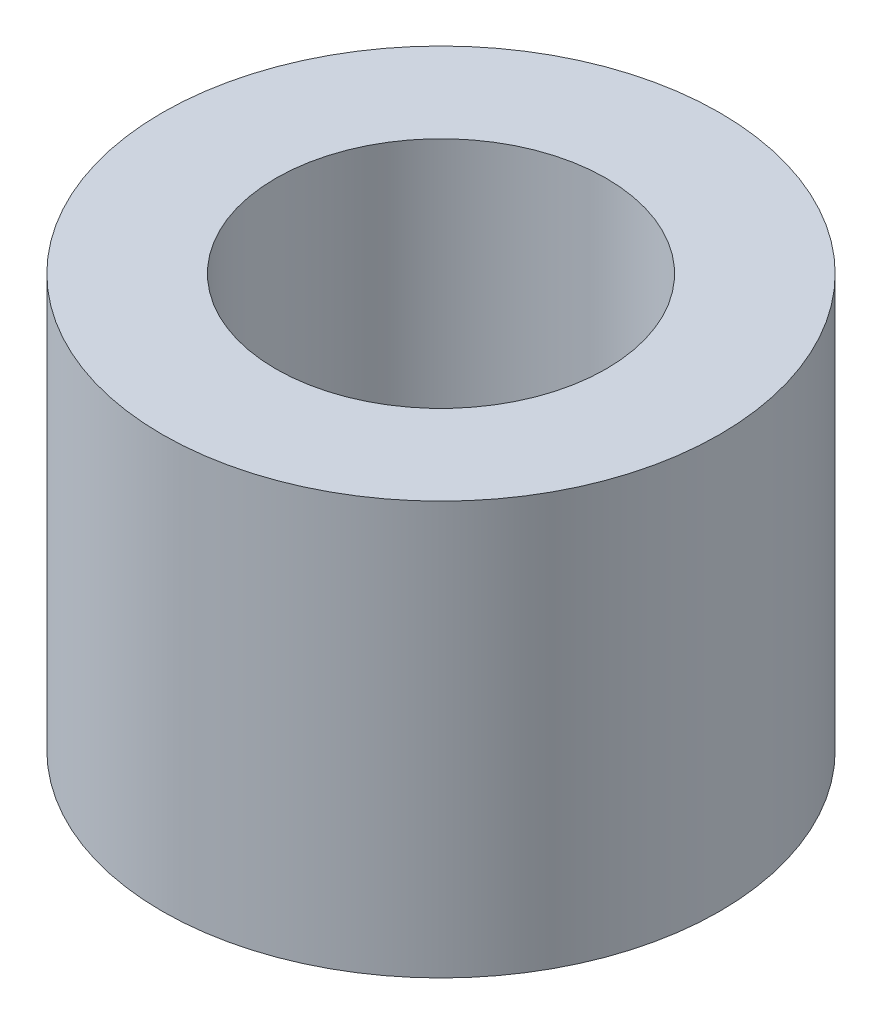
from build123d import *

# Parameters (mm, degrees)
SKETCH_1_R      = 2.7
SKETCH_1_R_2    = 1.6
EXTRUDE_1_DEPTH = 4


with BuildPart() as part:
    # 草图1 → 凸台-拉伸1 (new body)
    with BuildSketch(Plane(origin=(0, 0, 0), x_dir=(1, 0, 0), z_dir=(0, 1, 0))):
        with Locations(Location((0, 0, 0), (0, 0, 270))):
            Circle(SKETCH_1_R)
        with Locations(Location((0, 0, 0), (0, 0, 270))):
            Circle(SKETCH_1_R_2, mode=Mode.SUBTRACT)
    extrude(amount=EXTRUDE_1_DEPTH)


solid = part.part
